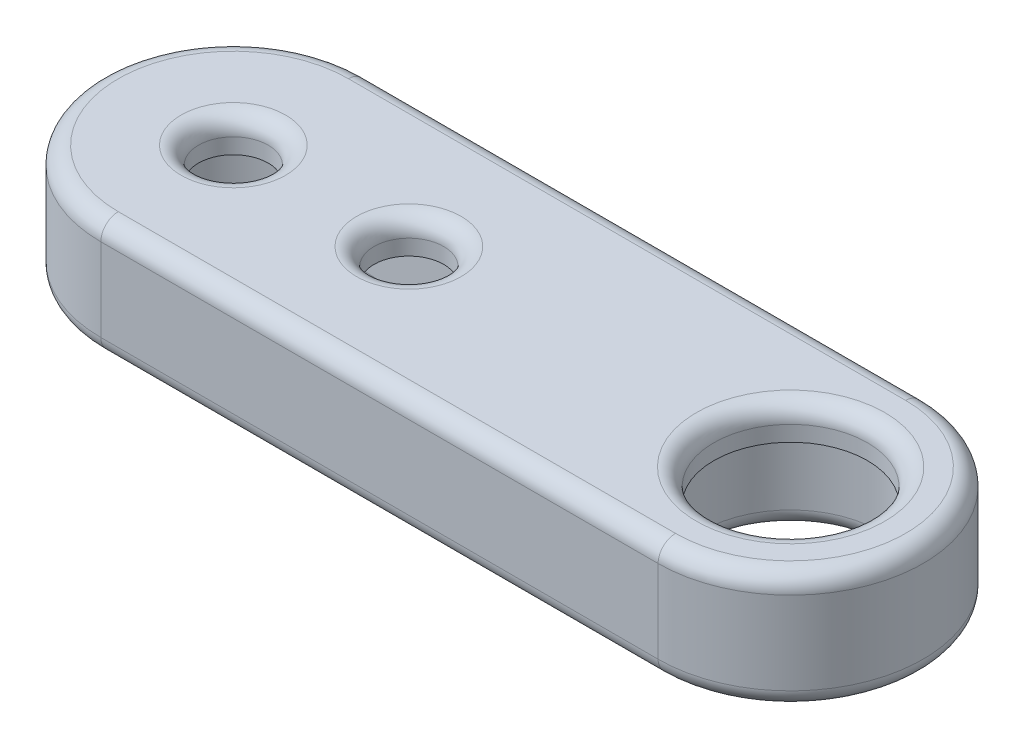
from build123d import *

# Parameters (mm, degrees)
SKETCH1_R           = 4.064
BOSS_EXTRUDE1_DEPTH = 4.5
SKETCH2_R           = 1.5875
SKETCH2_R_2         = 3.5
BOSS_EXTRUDE2_DEPTH = 1.5
CUT_EXTRUDE1_DEPTH  = 0.635
FILLET2_R           = 0.79375
FILLET3_R           = 0.79375


with BuildPart() as part:
    # Sketch1 → Boss-Extrude1 (new body)
    with BuildSketch(Plane(origin=(0, 0, 0), x_dir=(1, 0, 0), z_dir=(0, 1, 0))):
        with BuildLine():
            Line((0, 6.04), (25.4, 6.04))
            ThreePointArc((25.4, 6.04), (31.44, 0), (25.4, -6.04))
            Line((25.4, -6.04), (0, -6.04))
            ThreePointArc((0, -6.04), (-6.04, 0), (0, 6.04))
        make_face()
        with Locations(Location((25.4, 0, 0), (0, 0, 270))):
            Circle(SKETCH1_R, mode=Mode.SUBTRACT)
        with BuildLine():
            Line((2.286372673, 2.65), (14.110293316, 1.99695653))
            ThreePointArc((14.110293316, 1.99695653), (16, 0), (14.110293316, -1.99695653))
            Line((14.110293316, -1.99695653), (2.286372673, -2.65))
            ThreePointArc((2.286372673, -2.65), (-3.5, 0), (2.286372673, 2.65))
        make_face(mode=Mode.SUBTRACT)
    extrude(amount=BOSS_EXTRUDE1_DEPTH)

    # Sketch2 → Boss-Extrude2 (add)
    with BuildSketch(Plane(origin=(0, 4.5, 0), x_dir=(1, 0, 0), z_dir=(0, 1, 0))):
        with BuildLine():
            Line((25.4, 6.04), (0, 6.04))
            ThreePointArc((0, 6.04), (-6.04, 0), (0, -6.04))
            Line((0, -6.04), (25.4, -6.04))
            ThreePointArc((25.4, -6.04), (31.44, 0), (25.4, 6.04))
        make_face()
        with Locations(Location((0, 0, 0), (0, 0, 90))):
            Circle(SKETCH2_R, mode=Mode.SUBTRACT)
        with Locations(Location((8, 0, 0), (0, 0, 90))):
            Circle(SKETCH2_R, mode=Mode.SUBTRACT)
        with Locations(Location((25.4, 0, 0), (0, 0, 90))):
            Circle(SKETCH2_R_2, mode=Mode.SUBTRACT)
    extrude(amount=BOSS_EXTRUDE2_DEPTH)

    # Sketch3 → Cut-Extrude1 (cut)
    with BuildSketch(Plane.XZ):
        with BuildLine():
            Line((25.4, 6.04), (0, 6.04))
            ThreePointArc((0, 6.04), (-6.04, 0), (0, -6.04))
            Line((0, -6.04), (25.4, -6.04))
            ThreePointArc((25.4, -6.04), (31.44, 0), (25.4, 6.04))
        make_face()
    extrude(amount=-CUT_EXTRUDE1_DEPTH, mode=Mode.SUBTRACT)

    # Fillet2
    fillet2_edges = [part.edges().sort_by_distance(p)[0] for p in [
        (31.44, 0.635, 0),
        (12.7, 0.635, -6.04),
        (-6.04, 0.635, 0),
        (12.7, 0.635, 6.04),
        (8.198332995, 0.635, 2.323478265),
        (-3.5, 0.635, 0),
        (8.198332995, 0.635, -2.323478265),
        (16, 0.635, 0),
        (25.4, 0.635, -4.064),
    ]]
    fillet(fillet2_edges, radius=FILLET2_R)

    # Fillet3
    fillet3_edges = [part.edges().sort_by_distance(p)[0] for p in [
        (31.44, 6, 0),
        (12.7, 6, -6.04),
        (-6.04, 6, 0),
        (12.7, 6, 6.04),
        (8, 6, 1.5875),
        (25.4, 6, 3.5),
        (0, 6, 1.5875),
    ]]
    fillet(fillet3_edges, radius=FILLET3_R)


solid = part.part
